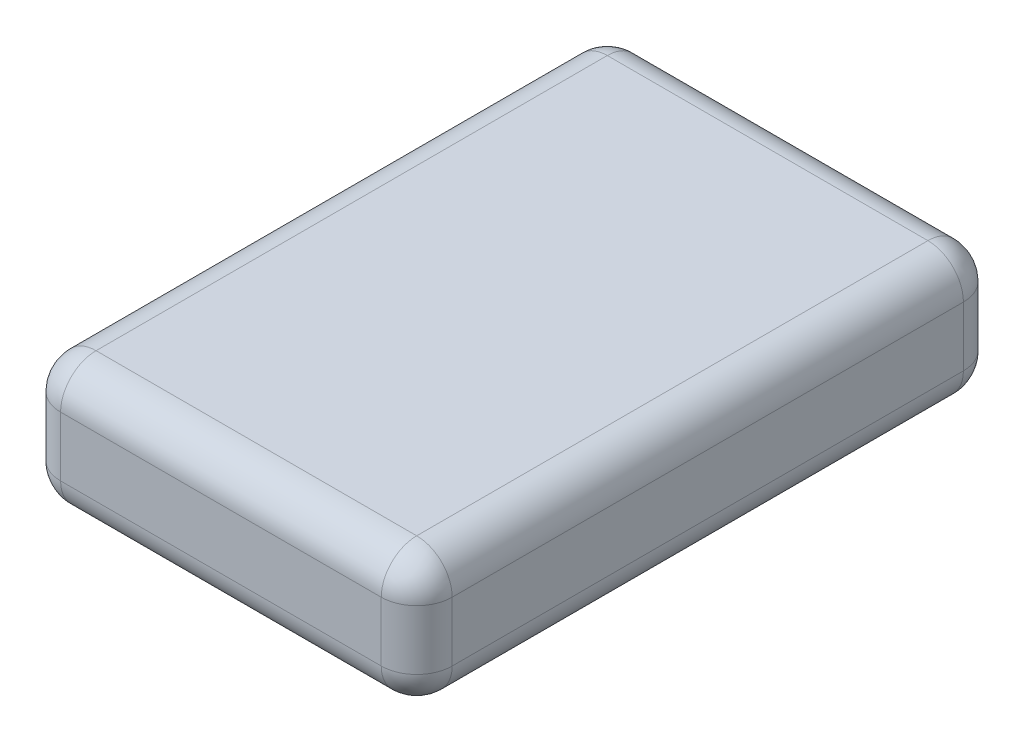
from build123d import *

# Parameters (mm, degrees)
SKETCH1_W           = 16.56
SKETCH1_H           = 24.62
BOSS_EXTRUDE1_DEPTH = 5.52
FILLET1_R           = 1.5


with BuildPart() as part:
    # Sketch1 → Boss-Extrude1 (new body)
    with BuildSketch(Plane(origin=(0, 0, 0), x_dir=(1, 0, 0), z_dir=(0, 1, 0))):
        Rectangle(SKETCH1_W, SKETCH1_H)
    extrude(amount=BOSS_EXTRUDE1_DEPTH)

    # Fillet1
    fillet1_edges = [part.edges().sort_by_distance(p)[0] for p in [
        (-8.28, 5.52, 0),
        (0, 5.52, 12.31),
        (8.28, 5.52, 0),
        (0, 0, 12.31),
        (-8.28, 0, 0),
        (0, 0, -12.31),
        (8.28, 0, 0),
        (8.28, 2.76, 12.31),
        (-8.28, 2.76, 12.31),
        (-8.28, 2.76, -12.31),
        (8.28, 2.76, -12.31),
        (0, 5.52, -12.31),
    ]]
    fillet(fillet1_edges, radius=FILLET1_R)


solid = part.part
